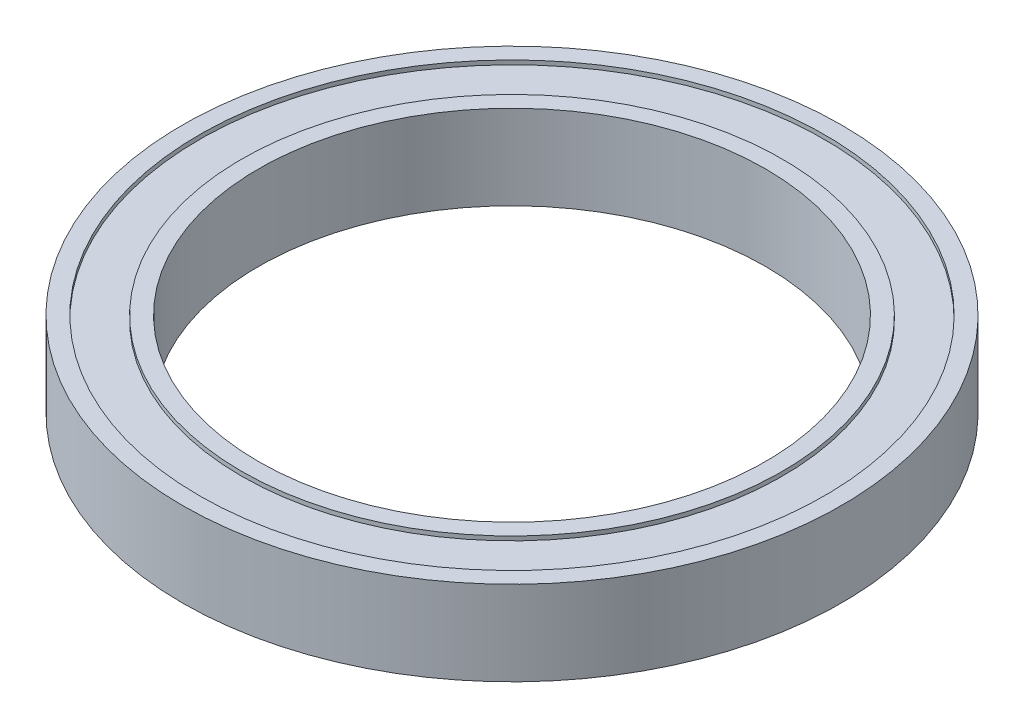
from build123d import *

# Parameters (mm, degrees)
SKETCH1_R           = 39
SKETCH1_R_2         = 30
BOSS_EXTRUDE1_DEPTH = 10
SKETCH2_R           = 37
SKETCH2_R_2         = 32
CUT_EXTRUDE1_DEPTH  = 0.5
CUT_EXTRUDE2_START  = -0.5
SKETCH3_R           = 37
SKETCH3_R_2         = 32
CUT_EXTRUDE2_DEPTH  = 0.5


with BuildPart() as part:
    # Sketch1 → Boss-Extrude1 (new body)
    with BuildSketch(Plane(origin=(0, 0, 0), x_dir=(1, 0, 0), z_dir=(0, 1, 0))):
        with Locations(Location((0, 0, 0), (0, 0, 270))):
            Circle(SKETCH1_R)
        with Locations(Location((0, 0, 0), (0, 0, 270))):
            Circle(SKETCH1_R_2, mode=Mode.SUBTRACT)
    extrude(amount=BOSS_EXTRUDE1_DEPTH)

    # Sketch2 → Cut-Extrude1 (cut)
    with BuildSketch(Plane(origin=(0, 10, 0), x_dir=(1, 0, 0), z_dir=(0, 1, 0))):
        with Locations(Location((0, 0, 0), (0, 0, 270))):
            Circle(SKETCH2_R)
        with Locations(Location((0, 0, 0), (0, 0, 270))):
            Circle(SKETCH2_R_2, mode=Mode.SUBTRACT)
    extrude(amount=-CUT_EXTRUDE1_DEPTH, mode=Mode.SUBTRACT)

    # Sketch3 → Cut-Extrude2 (cut)
    with BuildSketch(Plane.XZ.offset(CUT_EXTRUDE2_START)):
        with Locations(Location((0, 0, 0), (0, 0, 90))):
            Circle(SKETCH3_R)
        with Locations(Location((0, 0, 0), (0, 0, 90))):
            Circle(SKETCH3_R_2, mode=Mode.SUBTRACT)
    extrude(amount=CUT_EXTRUDE2_DEPTH, mode=Mode.SUBTRACT)


solid = part.part
